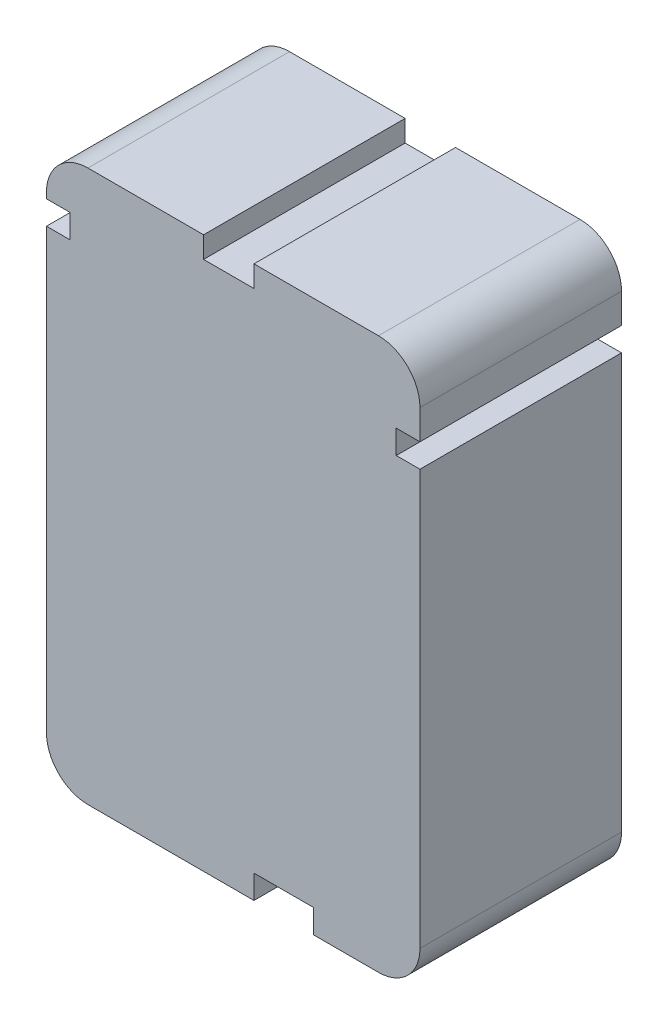
from build123d import *

# Parameters (mm, degrees)
ESTRUSIONE_ESTRUSIONE2_DEPTH = 17
TAGLIO_ESTRUSIONE1_DEPTH     = 0.5


with BuildPart() as part:
    # Schizzo1 → Estrusione-Estrusione2 (new body)
    with BuildSketch(Plane.XY):
        with BuildLine():
            Line((0, 43), (0, 42.5))
            Line((0, 42.5), (2, 42.5))
            Line((2, 42.5), (2, 40.5))
            Line((2, 40.5), (0, 40.5))
            Line((0, 40.5), (0, 3.5))
            ThreePointArc((0, 3.5), (1.025126266, 1.025126266), (3.5, 0))
            Line((3.5, 0), (17.5, 0))
            Line((17.5, 0), (17.5, 2))
            Line((17.5, 2), (22.5, 2))
            Line((22.5, 2), (22.5, 0))
            Line((22.5, 0), (28, 0))
            ThreePointArc((28, 0), (30.474873734, 1.025126266), (31.5, 3.5))
            Line((31.5, 3.5), (31.5, 38.5))
            Line((31.5, 38.5), (29.5, 38.5))
            Line((29.5, 38.5), (29.5, 40.5))
            Line((29.5, 40.5), (31.5, 40.5))
            Line((31.5, 40.5), (31.5, 43))
            ThreePointArc((31.5, 43), (30.474873734, 45.474873734), (28, 46.5))
            Line((28, 46.5), (17.5, 46.5))
            Line((17.5, 46.5), (17.5, 44.698582514))
            Line((17.5, 44.698582514), (13.25, 44.698582514))
            Line((13.25, 44.698582514), (13.25, 46.5))
            Line((13.25, 46.5), (3.5, 46.5))
            ThreePointArc((3.5, 46.5), (1.025126266, 45.474873734), (0, 43))
        make_face()
    extrude(amount=ESTRUSIONE_ESTRUSIONE2_DEPTH)

    # Schizzo2 → Taglio-Estrusione1 (cut)
    # profile 1 of 5: a face of its own
    with BuildSketch(Plane(origin=(0, 0, 0), x_dir=(-1, 0, 0), z_dir=(0, 0, -1))):
        with BuildLine():
            Line((-16.307077411, 31.237179487), (-16.10375209, 30.855769231))
            add(Edge.make_bspline(
                [(-16.10375209, 30.855769231), (-16.149793211, 30.827973719), (-16.237790547, 30.774848797), (-16.356333406, 30.687614978), (-16.45741931, 30.600880935), (-16.540946193, 30.513790499), (-16.605572368, 30.425133919), (-16.652279054, 30.335816279), (-16.681635758, 30.245278558), (-16.685288399, 30.184063082), (-16.687085424, 30.153946314)],
                knots=[0, 0, 0, 0, 1.354943589, 2.589672558, 3.704607527, 4.708856974, 5.624398268, 6.459549776, 7.242129862, 8, 8, 8, 8], degree=3))
            add(Edge.make_bspline(
                [(-16.687085424, 30.153946314), (-16.686181738, 30.125830618), (-16.684391795, 30.070141513), (-16.668866452, 29.988318499), (-16.645216498, 29.909087136), (-16.611520341, 29.83384432), (-16.570305734, 29.764262127), (-16.520945682, 29.702949432), (-16.465872876, 29.650095656), (-16.404258774, 29.607322145), (-16.339023781, 29.573370219), (-16.270962174, 29.549712473), (-16.200906581, 29.534918451), (-16.153604314, 29.533013973), (-16.129693597, 29.532051282)],
                knots=[0, 0, 0, 0, 1.088566894, 2.156137864, 3.216115032, 4.286409646, 5.342511199, 6.341014339, 7.327494598, 8.289734136, 9.237503728, 10.168335026, 11.074115738, 12, 12, 12, 12], degree=3))
            add(Edge.make_bspline(
                [(-16.129693597, 29.532051282), (-16.102425117, 29.533340723), (-16.047261716, 29.535949226), (-15.965917082, 29.559596137), (-15.884442316, 29.594502855), (-15.834037398, 29.628163898), (-15.807878693, 29.645633013)],
                knots=[0, 0, 0, 0, 0.942144539, 1.905933023, 2.913239343, 4, 4, 4, 4], degree=3))
            add(Edge.make_bspline(
                [(-15.807878693, 29.645633013), (-15.788807949, 29.660652632), (-15.748662414, 29.692270205), (-15.688222687, 29.74578979), (-15.625175085, 29.808414727), (-15.559804037, 29.880043431), (-15.490644775, 29.959416884), (-15.419484755, 30.047883374), (-15.345121361, 30.144817506), (-15.29523258, 30.212746255), (-15.269417154, 30.247896635)],
                knots=[0, 0, 0, 0, 0.718593868, 1.512701116, 2.388487339, 3.348232282, 4.383172848, 5.504845107, 6.708858268, 8, 8, 8, 8], degree=3))
            add(Edge.make_bspline(
                [(-15.269417154, 30.247896635), (-15.243359589, 30.283740822), (-15.193362419, 30.352515779), (-15.120066335, 30.449413689), (-15.052483284, 30.536292096), (-14.990560443, 30.612484782), (-14.933759606, 30.678000408), (-14.882313852, 30.73270096), (-14.837634989, 30.77823315), (-14.807572952, 30.802700851), (-14.794056577, 30.813701923)],
                knots=[0, 0, 0, 0, 1.435833971, 2.754963323, 3.936484598, 5.002077172, 5.935979083, 6.744956812, 7.435712417, 8, 8, 8, 8], degree=3))
            add(Edge.make_bspline(
                [(-14.794056577, 30.813701923), (-14.773305394, 30.829762001), (-14.732538024, 30.861313316), (-14.667144524, 30.901258372), (-14.600895174, 30.935630199), (-14.533176549, 30.963940496), (-14.464204985, 30.98587927), (-14.393738605, 31.00097211), (-14.322057314, 31.011618336), (-14.273629773, 31.012418344), (-14.249284943, 31.012820513)],
                knots=[0, 0, 0, 0, 1.064105702, 2.090521257, 3.104283852, 4.09061442, 5.065433238, 6.036507983, 7.012940167, 8, 8, 8, 8], degree=3))
            add(Edge.make_bspline(
                [(-14.249284943, 31.012820513), (-14.211317445, 31.011558428), (-14.136144577, 31.009059591), (-14.026440711, 30.986587547), (-13.921667056, 30.950477408), (-13.823177817, 30.899945167), (-13.731960865, 30.836772781), (-13.649586503, 30.762181239), (-13.579032914, 30.674450656), (-13.519319093, 30.576750029), (-13.470939577, 30.47137751), (-13.436444834, 30.360412304), (-13.415535754, 30.245179304), (-13.412818289, 30.166886726), (-13.411444398, 30.127303686)],
                knots=[0, 0, 0, 0, 1.004646316, 1.989126202, 2.95222254, 3.932177672, 4.910861341, 5.883497635, 6.864703059, 7.88170562, 8.909314152, 9.927333358, 10.952104425, 12, 12, 12, 12], degree=3))
            add(Edge.make_bspline(
                [(-13.411444398, 30.127303686), (-13.413053118, 30.082359333), (-13.416239196, 29.993346824), (-13.437830729, 29.862134019), (-13.476704803, 29.73666234), (-13.519614561, 29.63560875), (-13.56348641, 29.557108596), (-13.603110201, 29.497737323), (-13.647953051, 29.436884831), (-13.700250343, 29.376478497), (-13.757471737, 29.314164012), (-13.822727657, 29.253132377), (-13.892278204, 29.189521224), (-13.942436294, 29.148977802), (-13.968135103, 29.128205128)],
                knots=[0, 0, 0, 0, 1.360590218, 2.69465552, 4.010645498, 5.328858611, 6.009843139, 6.729980544, 7.488405022, 8.296451933, 9.147430815, 10.048128915, 10.999946711, 12, 12, 12, 12], degree=3))
            Line((-13.968135103, 29.128205128), (-14.219136706, 29.494190705))
            add(Edge.make_bspline(
                [(-14.219136706, 29.494190705), (-14.19870242, 29.513248513), (-14.159292721, 29.550003526), (-14.104114394, 29.604699839), (-14.054242166, 29.655816338), (-14.009866174, 29.703563469), (-13.970998953, 29.748080296), (-13.939035299, 29.790559957), (-13.911247185, 29.828569182), (-13.883183996, 29.875586233), (-13.856058823, 29.93402414), (-13.831807537, 30.005826048), (-13.818384506, 30.08100173), (-13.816332958, 30.131694545), (-13.815290552, 30.157451923)],
                knots=[0, 0, 0, 0, 1.253529984, 2.417566204, 3.48529857, 4.457251953, 5.342048711, 6.134767478, 6.841715926, 7.453097701, 8.588204789, 9.725488963, 10.844304836, 12, 12, 12, 12], degree=3))
            add(Edge.make_bspline(
                [(-13.815290552, 30.157451923), (-13.816584559, 30.184936406), (-13.819100216, 30.238368485), (-13.840298308, 30.314983287), (-13.874388881, 30.38517098), (-13.922167738, 30.447245731), (-13.980827686, 30.499769459), (-14.050350986, 30.537625566), (-14.129224164, 30.559880843), (-14.184633483, 30.562655609), (-14.213527731, 30.564102564)],
                knots=[0, 0, 0, 0, 1.033786987, 2.00976631, 2.970458119, 3.95651055, 4.942051941, 5.915168215, 6.91282465, 8, 8, 8, 8], degree=3))
            add(Edge.make_bspline(
                [(-14.213527731, 30.564102564), (-14.232250122, 30.563542162), (-14.269649617, 30.562422712), (-14.325017658, 30.55406059), (-14.378720368, 30.538973926), (-14.431205775, 30.518509432), (-14.482891242, 30.491446286), (-14.534094117, 30.457648584), (-14.585131769, 30.416409071), (-14.617398767, 30.384897999), (-14.634200808, 30.368489583)],
                knots=[0, 0, 0, 0, 0.941102048, 1.879927795, 2.806320176, 3.740133313, 4.70706341, 5.733547381, 6.819814909, 8, 8, 8, 8], degree=3))
            add(Edge.make_bspline(
                [(-14.634200808, 30.368489583), (-14.642024727, 30.360172908), (-14.659982259, 30.341084394), (-14.687480569, 30.30607401), (-14.721956103, 30.263419314), (-14.762846162, 30.21252896), (-14.807930762, 30.15172956), (-14.860221924, 30.083269081), (-14.917365562, 30.005414098), (-14.957427129, 29.950627328), (-14.97845161, 29.921875)],
                knots=[0, 0, 0, 0, 0.485581606, 1.114511607, 1.892484918, 2.819534315, 3.891398566, 5.11240712, 6.484579029, 8, 8, 8, 8], degree=3))
            add(Edge.make_bspline(
                [(-14.97845161, 29.921875), (-15.006998687, 29.882698529), (-15.062224002, 29.806910283), (-15.145608753, 29.699326209), (-15.226927501, 29.602162676), (-15.304887643, 29.513910905), (-15.380050291, 29.435348407), (-15.45344666, 29.367210797), (-15.522966832, 29.307770254), (-15.61169304, 29.244407467), (-15.720816768, 29.180667334), (-15.853468523, 29.125349806), (-15.986257739, 29.090141048), (-16.075270672, 29.085582072), (-16.11917677, 29.083333333)],
                knots=[0, 0, 0, 0, 1.186639563, 2.29559556, 3.331401308, 4.287832086, 5.178002532, 5.991653193, 6.738845359, 7.415240842, 8.658551622, 9.823054859, 10.926210341, 12, 12, 12, 12], degree=3))
            add(Edge.make_bspline(
                [(-16.11917677, 29.083333333), (-16.15031036, 29.084326801), (-16.212190752, 29.086301394), (-16.303684872, 29.100617737), (-16.392614018, 29.124438872), (-16.478602673, 29.158709891), (-16.562457862, 29.201455939), (-16.643446471, 29.25445818), (-16.721256418, 29.317543854), (-16.796357881, 29.38805148), (-16.865379054, 29.466015113), (-16.926126789, 29.549622258), (-16.976875109, 29.638617657), (-17.018048561, 29.732315519), (-17.051599811, 29.83016607), (-17.074579611, 29.9331363), (-17.087843891, 30.040716929), (-17.089891503, 30.113945661), (-17.090931577, 30.151141827)],
                knots=[0, 0, 0, 0, 0.932646097, 1.853705421, 2.767602683, 3.685675702, 4.622099834, 5.5835355, 6.579838097, 7.620108014, 8.666886363, 9.695041649, 10.711275682, 11.730160242, 12.757671447, 13.80585424, 14.885494678, 16, 16, 16, 16], degree=3))
            add(Edge.make_bspline(
                [(-17.090931577, 30.151141827), (-17.090329122, 30.178265694), (-17.089142533, 30.231688497), (-17.08161579, 30.310998793), (-17.067149464, 30.388177591), (-17.048445963, 30.463648035), (-17.024629579, 30.537457228), (-16.994164057, 30.608653975), (-16.959170196, 30.678423865), (-16.918196009, 30.746366664), (-16.870218462, 30.812569015), (-16.814525966, 30.877407134), (-16.750139517, 30.940504394), (-16.67789563, 31.002942416), (-16.59698171, 31.06389631), (-16.50782323, 31.123223774), (-16.410707699, 31.181682313), (-16.342301699, 31.218315808), (-16.307077411, 31.237179487)],
                knots=[0, 0, 0, 0, 0.916943493, 1.805999526, 2.689245248, 3.568702553, 4.433092864, 5.307568578, 6.183755457, 7.069823058, 7.986358083, 8.944343836, 9.955449961, 11.030835633, 12.170024038, 13.377301724, 14.649494474, 16, 16, 16, 16], degree=3))
        make_face()
    # profile 2 of 5: a face of its own
    with BuildSketch(Plane(origin=(0, 0, 0), x_dir=(-1, 0, 0), z_dir=(0, 0, -1))):
        with BuildLine():
            add(Edge.make_bspline(
                [(-13.411444398, 26.771734776), (-13.412994819, 26.704577605), (-13.416042203, 26.572578844), (-13.442024312, 26.378937496), (-13.483590296, 26.194016109), (-13.542961349, 26.018087443), (-13.619033646, 25.851032726), (-13.711953387, 25.692588408), (-13.82200206, 25.543224999), (-13.947768944, 25.404768655), (-14.084767073, 25.278998214), (-14.229583029, 25.167538653), (-14.382857995, 25.074984045), (-14.542373991, 24.997613026), (-14.709610859, 24.939069304), (-14.883151668, 24.895694678), (-15.064159015, 24.870113406), (-15.187305447, 24.866976284), (-15.249785744, 24.865384615)],
                knots=[0, 0, 0, 0, 1.090651108, 2.14369656, 3.167927427, 4.165692988, 5.154576575, 6.145033357, 7.14440862, 8.163220312, 9.178978109, 10.162394332, 11.12677451, 12.082874982, 13.037579715, 13.999894772, 14.985214855, 16, 16, 16, 16], degree=3))
            add(Edge.make_bspline(
                [(-15.249785744, 24.865384615), (-15.311809075, 24.86693895), (-15.434045359, 24.87000225), (-15.613912875, 24.896171768), (-15.787456382, 24.937865225), (-15.954020505, 24.99806208), (-16.114161007, 25.073989832), (-16.267327176, 25.167307124), (-16.413146108, 25.277998194), (-16.551088144, 25.403327661), (-16.677320594, 25.54101304), (-16.788128701, 25.688882903), (-16.881679318, 25.845210968), (-16.958785507, 26.009244494), (-17.017602526, 26.181756002), (-17.060642355, 26.361940759), (-17.086229766, 26.550612218), (-17.089347572, 26.679108397), (-17.090931577, 26.744391026)],
                knots=[0, 0, 0, 0, 1.015700553, 2.001754173, 2.97127738, 3.93532631, 4.897845697, 5.870365868, 6.86818415, 7.892758882, 8.919913123, 9.923854125, 10.914742825, 11.89967328, 12.887739446, 13.895382781, 14.930746853, 16, 16, 16, 16], degree=3))
            add(Edge.make_bspline(
                [(-17.090931577, 26.744391026), (-17.089391754, 26.80804967), (-17.08636184, 26.933310931), (-17.060146142, 27.117079616), (-17.019205938, 27.293357969), (-16.960693374, 27.461869916), (-16.885087531, 27.622723827), (-16.793008942, 27.775899032), (-16.684005373, 27.921314654), (-16.559960386, 28.057320114), (-16.424797088, 28.18237846), (-16.279487081, 28.290496084), (-16.128046052, 28.383116927), (-15.969759829, 28.459478721), (-15.803691535, 28.51799963), (-15.630658994, 28.558808801), (-15.450879143, 28.585166511), (-15.328638307, 28.588202907), (-15.266612667, 28.58974359)],
                knots=[0, 0, 0, 0, 1.056823085, 2.079513228, 3.076571628, 4.058624937, 5.036242006, 6.023459724, 7.021809304, 8.049518301, 9.076978038, 10.075327618, 11.052582442, 12.021343849, 12.988743439, 13.970697019, 14.970321038, 16, 16, 16, 16], degree=3))
            add(Edge.make_bspline(
                [(-15.266612667, 28.58974359), (-15.224979806, 28.589209446), (-15.142239302, 28.588147898), (-15.019375522, 28.575348964), (-14.898474293, 28.556814404), (-14.779942495, 28.530111976), (-14.663759029, 28.495670099), (-14.550168006, 28.453218974), (-14.438209258, 28.40459716), (-14.33010552, 28.346602734), (-14.225227601, 28.283637937), (-14.126397376, 28.213667002), (-14.032392747, 28.139665388), (-13.945791434, 28.058460707), (-13.863674352, 27.972845424), (-13.788406376, 27.880746847), (-13.717714851, 27.78401902), (-13.654618734, 27.681625999), (-13.596591584, 27.57634945), (-13.548161715, 27.467339717), (-13.505351227, 27.356919584), (-13.471330799, 27.24411037), (-13.444256816, 27.129174624), (-13.425860805, 27.011968235), (-13.413033455, 26.89261204), (-13.411976363, 26.812200555), (-13.411444398, 26.771734776)],
                knots=[0, 0, 0, 0, 1.03694719, 2.060812827, 3.074677115, 4.083377489, 5.085687055, 6.09167756, 7.10333197, 8.124461567, 9.146122363, 10.149378781, 11.13975921, 12.124577204, 13.104891394, 14.093558362, 15.085973957, 16.087792837, 17.088392424, 18.078772854, 19.05751188, 20.0375147, 21.012156822, 21.997267452, 22.992157243, 24, 24, 24, 24], degree=3))
        make_face()
        with BuildLine():
            add(Edge.make_bspline(
                [(-13.815290552, 26.757011218), (-13.815757099, 26.78648441), (-13.816685072, 26.845107247), (-13.826398521, 26.932439643), (-13.840989622, 27.018867632), (-13.861510085, 27.104541228), (-13.887152158, 27.189529887), (-13.919950502, 27.273106554), (-13.957496279, 27.35606172), (-14.001929734, 27.436980399), (-14.050528887, 27.515832222), (-14.103702686, 27.590963006), (-14.161773688, 27.661519651), (-14.224030947, 27.728332803), (-14.291531465, 27.790292963), (-14.362307545, 27.849198541), (-14.438732916, 27.902359694), (-14.518766574, 27.951762854), (-14.602178853, 27.997130369), (-14.689070766, 28.035401776), (-14.778604812, 28.067798324), (-14.870663325, 28.094393023), (-14.965434717, 28.115699214), (-15.06295241, 28.129954612), (-15.163116061, 28.139698848), (-15.230831364, 28.140578859), (-15.265210424, 28.141025641)],
                knots=[0, 0, 0, 0, 0.951396983, 1.892349817, 2.834058984, 3.780443919, 4.735366488, 5.69821879, 6.677581435, 7.673809759, 8.676988862, 9.66748345, 10.643467165, 11.625907292, 12.613868494, 13.600473973, 14.597130997, 15.617117015, 16.636851718, 17.660600043, 18.679999565, 19.709407066, 20.75310113, 21.814034083, 22.890185104, 24, 24, 24, 24], degree=3))
            add(Edge.make_bspline(
                [(-15.265210424, 28.141025641), (-15.315295273, 28.139940348), (-15.413529624, 28.137811698), (-15.557620359, 28.11728294), (-15.695309494, 28.085456303), (-15.826457676, 28.040407179), (-15.951025219, 27.982401648), (-16.068976138, 27.911407281), (-16.180605997, 27.827305069), (-16.283769671, 27.731098363), (-16.378032619, 27.626800659), (-16.460172282, 27.516171901), (-16.531200244, 27.401744883), (-16.588131333, 27.28168324), (-16.632498626, 27.157163809), (-16.664069036, 27.027975197), (-16.683588611, 26.894093543), (-16.68590929, 26.803118114), (-16.687085424, 26.757011218)],
                knots=[0, 0, 0, 0, 1.087324682, 2.132633634, 3.154656843, 4.153212625, 5.138884617, 6.133989092, 7.13811672, 8.169089965, 9.193543553, 10.187520856, 11.158295186, 12.114249704, 13.068004623, 14.02467326, 14.998892505, 16, 16, 16, 16], degree=3))
            add(Edge.make_bspline(
                [(-16.687085424, 26.757011218), (-16.686618314, 26.72426949), (-16.685692238, 26.659356845), (-16.676104557, 26.563134746), (-16.661372863, 26.46880193), (-16.64131125, 26.376152571), (-16.614362615, 26.285647242), (-16.582145299, 26.196757056), (-16.543377594, 26.110033174), (-16.499625278, 26.025201372), (-16.449559391, 25.94449661), (-16.396653757, 25.866794686), (-16.338022053, 25.794354089), (-16.275009003, 25.726678446), (-16.208252677, 25.662900336), (-16.136341966, 25.604871743), (-16.060488007, 25.550784556), (-15.980853901, 25.500977641), (-15.897658799, 25.456969982), (-15.811625463, 25.418910739), (-15.723453778, 25.386946226), (-15.63324687, 25.359775113), (-15.540352356, 25.339673152), (-15.445284327, 25.325156277), (-15.347908907, 25.315460194), (-15.282294536, 25.314558796), (-15.249084622, 25.314102564)],
                knots=[0, 0, 0, 0, 1.036852455, 2.055628653, 3.059747776, 4.060258094, 5.055826235, 6.04883128, 7.053059558, 8.062974786, 9.069819239, 10.059618002, 11.038895872, 12.0184815, 12.987265648, 13.960790191, 14.942722805, 15.936968883, 16.933774866, 17.921467318, 18.914472363, 19.902941347, 20.903451665, 21.922200966, 22.948347364, 24, 24, 24, 24], degree=3))
            add(Edge.make_bspline(
                [(-15.249084622, 25.314102564), (-15.216108473, 25.314560889), (-15.150960685, 25.315466356), (-15.054511884, 25.32510755), (-14.960607365, 25.339656258), (-14.868919172, 25.359898909), (-14.779802269, 25.386809498), (-14.692839021, 25.418929293), (-14.608213311, 25.456991142), (-14.526370898, 25.500941931), (-14.44815352, 25.551076758), (-14.372517705, 25.604721584), (-14.30207219, 25.664660033), (-14.234995626, 25.728488642), (-14.172530145, 25.797645924), (-14.11375271, 25.871147685), (-14.058530823, 25.949332399), (-14.008794755, 26.03236132), (-13.963097088, 26.11802601), (-13.924126282, 26.205868377), (-13.890019225, 26.294369817), (-13.86261892, 26.384346182), (-13.841726889, 26.475780472), (-13.82613989, 26.568445652), (-13.816770135, 26.662398108), (-13.81578427, 26.725439999), (-13.815290552, 26.757011218)],
                knots=[0, 0, 0, 0, 1.04873325, 2.071880859, 3.080308502, 4.070593695, 5.056178938, 6.039490106, 7.017841856, 8.005807845, 8.991729541, 9.971831222, 10.953285545, 11.931354755, 12.915593033, 13.915322425, 14.923969303, 15.958052794, 16.992376803, 18.010731872, 19.013194467, 20.008046291, 20.999976778, 21.994911943, 22.995857013, 24, 24, 24, 24], degree=3))
        make_face(mode=Mode.SUBTRACT)
    # profile 3 of 5: a face of its own
    with BuildSketch(Plane(origin=(0, 0, 0), x_dir=(-1, 0, 0), z_dir=(0, 0, -1))):
        with BuildLine():
            Line((-13.501187988, 24.147435897), (-13.501187988, 23.430188301))
            add(Edge.make_bspline(
                [(-13.501187988, 23.430188301), (-13.501213835, 23.382742967), (-13.50126337, 23.29181603), (-13.50462005, 23.161417078), (-13.507517142, 23.043115865), (-13.513085601, 22.936737595), (-13.520713323, 22.842524465), (-13.52968261, 22.760442655), (-13.53977058, 22.690404032), (-13.548890909, 22.648165253), (-13.553071001, 22.62880609)],
                knots=[0, 0, 0, 0, 1.415450773, 2.712650385, 3.891531898, 4.945867971, 5.890285756, 6.71109784, 7.409261617, 8, 8, 8, 8], degree=3))
            add(Edge.make_bspline(
                [(-13.553071001, 22.62880609), (-13.560079164, 22.601553478), (-13.573904121, 22.547792428), (-13.602401448, 22.470939008), (-13.634782785, 22.398015494), (-13.671617652, 22.32927086), (-13.714159947, 22.265407306), (-13.760381485, 22.205047008), (-13.812620086, 22.150046558), (-13.868341539, 22.098521686), (-13.928818566, 22.053313466), (-13.992004808, 22.01280677), (-14.058818027, 21.97923288), (-14.1290097, 21.951640823), (-14.202213862, 21.930071114), (-14.278663754, 21.914555711), (-14.358191732, 21.905232673), (-14.412387111, 21.904314037), (-14.439990071, 21.903846154)],
                knots=[0, 0, 0, 0, 1.085641105, 2.141637125, 3.15936318, 4.164535163, 5.147931294, 6.118832473, 7.09541784, 8.072503165, 9.045079613, 10.006206652, 10.966486436, 11.926469503, 12.914201526, 13.908586125, 14.934794539, 16, 16, 16, 16], degree=3))
            add(Edge.make_bspline(
                [(-14.439990071, 21.903846154), (-14.467591745, 21.904324302), (-14.522016858, 21.905267116), (-14.602020266, 21.914531281), (-14.678628973, 21.930060744), (-14.752181412, 21.950997356), (-14.822220149, 21.978512708), (-14.889336476, 22.011391276), (-14.95276998, 22.05113516), (-15.012960957, 22.09650749), (-15.068984401, 22.147745798), (-15.12062767, 22.204107499), (-15.166988834, 22.266333449), (-15.208900028, 22.333785451), (-15.247096188, 22.406228465), (-15.279949077, 22.484391275), (-15.307942868, 22.56792516), (-15.322827934, 22.62589956), (-15.330414751, 22.655448718)],
                knots=[0, 0, 0, 0, 1.042501879, 2.055610221, 3.037454288, 3.993184118, 4.940927036, 5.876790881, 6.812738028, 7.76458517, 8.720845088, 9.677105007, 10.648370915, 11.647960469, 12.67482723, 13.739162042, 14.847666245, 16, 16, 16, 16], degree=3))
            add(Edge.make_bspline(
                [(-15.330414751, 22.655448718), (-15.335124874, 22.677134401), (-15.345449029, 22.724667415), (-15.355928218, 22.803200309), (-15.364854827, 22.894654856), (-15.372381713, 22.999165262), (-15.378812705, 23.116960842), (-15.382565697, 23.247878605), (-15.385672239, 23.391845541), (-15.385758392, 23.492118625), (-15.385803372, 23.544471154)],
                knots=[0, 0, 0, 0, 0.596757494, 1.308037287, 2.12940859, 3.068703649, 4.126414758, 5.302667171, 6.591723825, 8, 8, 8, 8], degree=3))
            Line((-15.385803372, 23.544471154), (-15.385803372, 23.698717949))
            Line((-15.385803372, 23.698717949), (-17.001187988, 23.698717949))
            Line((-17.001187988, 23.698717949), (-17.001187988, 24.147435897))
            Line((-17.001187988, 24.147435897), (-13.501187988, 24.147435897))
        make_face()
        with BuildLine():
            Line((-13.905034142, 23.698717949), (-14.983359462, 23.698717949))
            Line((-14.983359462, 23.698717949), (-14.988968436, 23.193910256))
            add(Edge.make_bspline(
                [(-14.988968436, 23.193910256), (-14.988593051, 23.165396806), (-14.9878698, 23.110460364), (-14.98534659, 23.03118437), (-14.980261398, 22.958261684), (-14.974190504, 22.891345436), (-14.966103561, 22.830681139), (-14.955272368, 22.776268919), (-14.943898908, 22.727819325), (-14.925291143, 22.672331313), (-14.896790446, 22.61048644), (-14.852415592, 22.545223244), (-14.800192263, 22.48723354), (-14.738319841, 22.439448174), (-14.670442582, 22.400552747), (-14.597223979, 22.373272155), (-14.520284141, 22.355637006), (-14.467430372, 22.353596442), (-14.440691193, 22.352564103)],
                knots=[0, 0, 0, 0, 1.196815294, 2.30588621, 3.328293214, 4.264286585, 5.125717823, 5.895180743, 6.592215829, 7.212568914, 8.349102493, 9.437287391, 10.513425672, 11.61028466, 12.704025382, 13.784312881, 14.879064718, 16, 16, 16, 16], degree=3))
            add(Edge.make_bspline(
                [(-14.440691193, 22.352564103), (-14.414884021, 22.353606406), (-14.363645821, 22.355675822), (-14.288829852, 22.373390093), (-14.217026121, 22.400674693), (-14.150153728, 22.439676886), (-14.088420206, 22.486430859), (-14.036413479, 22.542707654), (-13.992540941, 22.605039951), (-13.965187652, 22.663744991), (-13.947175056, 22.716094361), (-13.936628193, 22.762258316), (-13.926666205, 22.814622314), (-13.918394378, 22.873102556), (-13.912112827, 22.937899894), (-13.908266203, 23.00877897), (-13.905179554, 23.085910706), (-13.905083856, 23.139452802), (-13.905034142, 23.167267628)],
                knots=[0, 0, 0, 0, 1.114109679, 2.211981052, 3.305661883, 4.423292243, 5.546705333, 6.640152885, 7.72177802, 8.828812749, 9.426174702, 10.112190932, 10.87296877, 11.730117113, 12.663899709, 13.685959007, 14.797868336, 16, 16, 16, 16], degree=3))
            Line((-13.905034142, 23.167267628), (-13.905034142, 23.698717949))
        make_face(mode=Mode.SUBTRACT)
    # profile 4 of 5: a face of its own
    with BuildSketch(Plane(origin=(0, 0, 0), x_dir=(-1, 0, 0), z_dir=(0, 0, -1))):
        with BuildLine():
            Line((-13.501187988, 21.230769231), (-13.501187988, 20.514222756))
            add(Edge.make_bspline(
                [(-13.501187988, 20.514222756), (-13.501299313, 20.468180957), (-13.50151237, 20.380065207), (-13.503748107, 20.253626088), (-13.506709143, 20.138822732), (-13.512894319, 20.035568373), (-13.518353884, 19.943586508), (-13.527333338, 19.863274973), (-13.535342038, 19.794255655), (-13.544153217, 19.752759105), (-13.548163148, 19.733874199)],
                knots=[0, 0, 0, 0, 1.411347063, 2.701065231, 3.876524531, 4.931206492, 5.871916627, 6.700262025, 7.408494688, 8, 8, 8, 8], degree=3))
            add(Edge.make_bspline(
                [(-13.548163148, 19.733874199), (-13.555242167, 19.705715554), (-13.569188912, 19.650238733), (-13.596642676, 19.570310126), (-13.629025414, 19.494862694), (-13.666084812, 19.423938314), (-13.708375286, 19.357419025), (-13.756118667, 19.296010846), (-13.808335102, 19.23847151), (-13.865593624, 19.186434758), (-13.926524809, 19.139100588), (-13.991102476, 19.098713239), (-14.058215246, 19.063757815), (-14.128512994, 19.035858457), (-14.20170713, 19.013939425), (-14.278023568, 18.99884103), (-14.356967826, 18.988376544), (-14.410741853, 18.987581049), (-14.437886706, 18.987179487)],
                knots=[0, 0, 0, 0, 1.103566178, 2.174193474, 3.209120605, 4.222655071, 5.213578804, 6.20178964, 7.176687246, 8.164138734, 9.139886382, 10.106283289, 11.056115697, 12.013153004, 12.977464204, 13.956846536, 14.968626638, 16, 16, 16, 16], degree=3))
            add(Edge.make_bspline(
                [(-14.437886706, 18.987179487), (-14.4826537, 18.9886797), (-14.570635968, 18.991628126), (-14.698950677, 19.018424837), (-14.819909362, 19.062333859), (-14.914389199, 19.112426259), (-14.984651889, 19.161135939), (-15.034540164, 19.201972926), (-15.081647059, 19.246772286), (-15.12500581, 19.295997765), (-15.165256666, 19.348992552), (-15.20239558, 19.405982238), (-15.23688611, 19.466966253), (-15.278208782, 19.554954621), (-15.321310569, 19.673934028), (-15.358249154, 19.827678024), (-15.380690016, 19.993806178), (-15.384064304, 20.108669432), (-15.385803372, 20.16786859)],
                knots=[0, 0, 0, 0, 1.259013566, 2.474386995, 3.67100949, 4.871820158, 5.472216481, 6.075345816, 6.684899195, 7.300071347, 7.919799613, 8.556611833, 9.213496572, 9.890338143, 11.290988261, 12.766925877, 14.333711956, 16, 16, 16, 16], degree=3))
            Line((-15.385803372, 20.16786859), (-17.001187988, 18.942307692))
            Line((-17.001187988, 18.942307692), (-17.001187988, 19.436598558))
            Line((-17.001187988, 19.436598558), (-15.385803372, 20.662159455))
            Line((-15.385803372, 20.662159455), (-15.385803372, 20.782051282))
            Line((-15.385803372, 20.782051282), (-17.001187988, 20.782051282))
            Line((-17.001187988, 20.782051282), (-17.001187988, 21.230769231))
            Line((-17.001187988, 21.230769231), (-13.501187988, 21.230769231))
        make_face()
        with BuildLine():
            Line((-13.905034142, 20.782051282), (-14.98265834, 20.782051282))
            Line((-14.98265834, 20.782051282), (-14.986163949, 20.267427885))
            add(Edge.make_bspline(
                [(-14.986163949, 20.267427885), (-14.986093988, 20.239847694), (-14.985958769, 20.186541086), (-14.983105212, 20.109383126), (-14.978430685, 20.038040486), (-14.971215158, 19.972369991), (-14.963018204, 19.91271727), (-14.953538077, 19.858475847), (-14.940856751, 19.810571259), (-14.922560477, 19.754614576), (-14.8931712, 19.692445441), (-14.848422667, 19.626495726), (-14.79546439, 19.568688418), (-14.733410933, 19.521283446), (-14.665331492, 19.483354396), (-14.592643129, 19.45576188), (-14.515755573, 19.439140355), (-14.463208931, 19.436990713), (-14.436484462, 19.435897436)],
                knots=[0, 0, 0, 0, 1.165827708, 2.253295501, 3.26337893, 4.187472566, 5.045344469, 5.808822722, 6.513324753, 7.138161794, 8.296050751, 9.405818329, 10.496423012, 11.595141695, 12.691948749, 13.780044643, 14.870962519, 16, 16, 16, 16], degree=3))
            add(Edge.make_bspline(
                [(-14.436484462, 19.435897436), (-14.410697256, 19.437023509), (-14.359549303, 19.439257032), (-14.284701995, 19.455668617), (-14.21355483, 19.483440777), (-14.14734089, 19.522045118), (-14.087230091, 19.569359954), (-14.035360689, 19.62461954), (-13.992891366, 19.687100294), (-13.965033275, 19.745128793), (-13.947202233, 19.797336289), (-13.936531763, 19.84370183), (-13.926760983, 19.896337936), (-13.918326208, 19.955258725), (-13.912131676, 20.020535656), (-13.90824342, 20.092344977), (-13.905185187, 20.170647122), (-13.90508576, 20.225123397), (-13.905034142, 20.253405449)],
                knots=[0, 0, 0, 0, 1.113757055, 2.20909524, 3.293015542, 4.401541292, 5.508686274, 6.587514178, 7.663075983, 8.760646327, 9.35781921, 10.043618311, 10.814080024, 11.670957073, 12.614495048, 13.646311651, 14.778052735, 16, 16, 16, 16], degree=3))
            Line((-13.905034142, 20.253405449), (-13.905034142, 20.782051282))
        make_face(mode=Mode.SUBTRACT)
    # profile 5 of 5: a face of its own
    with BuildSketch(Plane(origin=(0, 0, 0), x_dir=(-1, 0, 0), z_dir=(0, 0, -1))):
        Polygon((-13.501187988, 16.766025641), (-17.001187988, 15.128205128), (-17.001187988, 15.588842147), (-15.879393116, 16.120292468), (-15.879393116, 17.550580929), (-17.001187988, 18.082732372), (-17.001187988, 18.538461538), (-13.501187988, 16.90625), align=None)
        Polygon((-14.266812988, 16.836137821), (-15.475546962, 17.379507212), (-15.475546962, 16.285757212), align=None, mode=Mode.SUBTRACT)
    extrude(amount=-TAGLIO_ESTRUSIONE1_DEPTH, mode=Mode.SUBTRACT)


solid = part.part
